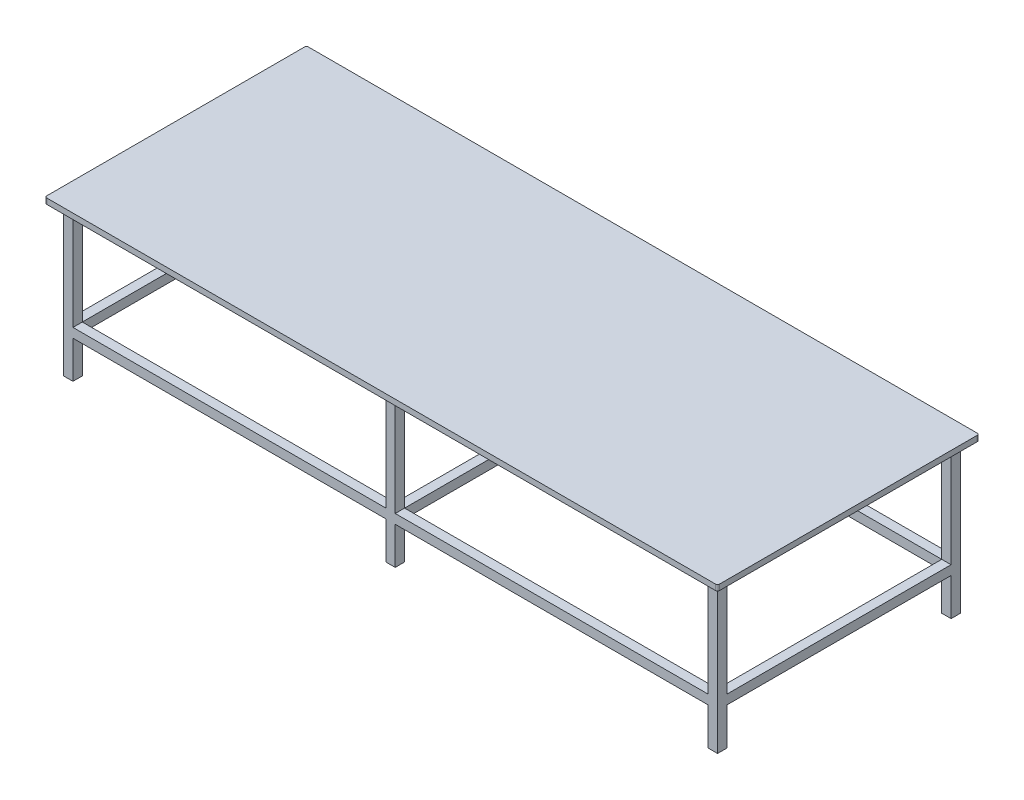
from build123d import *

# Parameters (mm, degrees)
Y_KSEKLIK_EKSTR_ZYON1_DEPTH = 30
IZIM2_W                     = 50
IZIM2_H                     = 50
IZIM2_W_2                   = 50.08957129
Y_KSEKLIK_EKSTR_ZYON2_DEPTH = 800
IZIM3_W                     = 1674.955214355
IZIM3_H                     = 1200
Y_KSEKLIK_EKSTR_ZYON3_DEPTH = 50


with BuildPart() as part:
    # Çizim1 → Yükseklik-Ekstrüzyon1 (new body)
    with BuildSketch(Plane(origin=(0, 0, 0), x_dir=(1, 0, 0), z_dir=(0, 1, 0))):
        with BuildLine():
            Line((1790, -700), (-1790, -700))
            ThreePointArc((-1790, -700), (-1797.071067812, -697.071067812), (-1800, -690))
            Line((-1800, -690), (-1800, 690))
            ThreePointArc((-1800, 690), (-1797.071067812, 697.071067812), (-1790, 700))
            Line((-1790, 700), (1790, 700))
            ThreePointArc((1790, 700), (1797.071067812, 697.071067812), (1800, 690))
            Line((1800, 690), (1800, -690))
            ThreePointArc((1800, -690), (1797.071067812, -697.071067812), (1790, -700))
        make_face()
    extrude(amount=Y_KSEKLIK_EKSTR_ZYON1_DEPTH)

    # Çizim2 → Yükseklik-Ekstrüzyon2 (add)
    with BuildSketch(Plane.XZ):
        with Locations((-1725, 625)):
            Rectangle(IZIM2_W, IZIM2_H)
        with Locations((-1725, -625)):
            Rectangle(IZIM2_W, IZIM2_H)
        with Locations((1725, -625)):
            Rectangle(IZIM2_W, IZIM2_H)
        with Locations((1725, 625)):
            Rectangle(IZIM2_W, IZIM2_H)
        with Locations((0, -625)):
            Rectangle(IZIM2_W_2, IZIM2_H)
        with Locations((0, 625)):
            Rectangle(IZIM2_W_2, IZIM2_H)
    extrude(amount=Y_KSEKLIK_EKSTR_ZYON2_DEPTH)

    # Çizim3 → Yükseklik-Ekstrüzyon3 (add)
    with BuildSketch(Plane(origin=(0, -600, 0), x_dir=(-1, 0, 0), z_dir=(0, -1, 0))):
        Polygon((-25.044785645, -650), (25.044785645, -650), (1700, -650), (1750, -650), (1750, 650), (1700, 650), (25.044785645, 650), (-25.044785645, 650), (-1700, 650), (-1750, 650), (-1750, -650), (-1700, -650), align=None)
        with Locations((-862.522392823, 0)):
            Rectangle(IZIM3_W, IZIM3_H, mode=Mode.SUBTRACT)
        with Locations((862.522392823, 0)):
            Rectangle(IZIM3_W, IZIM3_H, mode=Mode.SUBTRACT)
    extrude(amount=-Y_KSEKLIK_EKSTR_ZYON3_DEPTH)


solid = part.part
